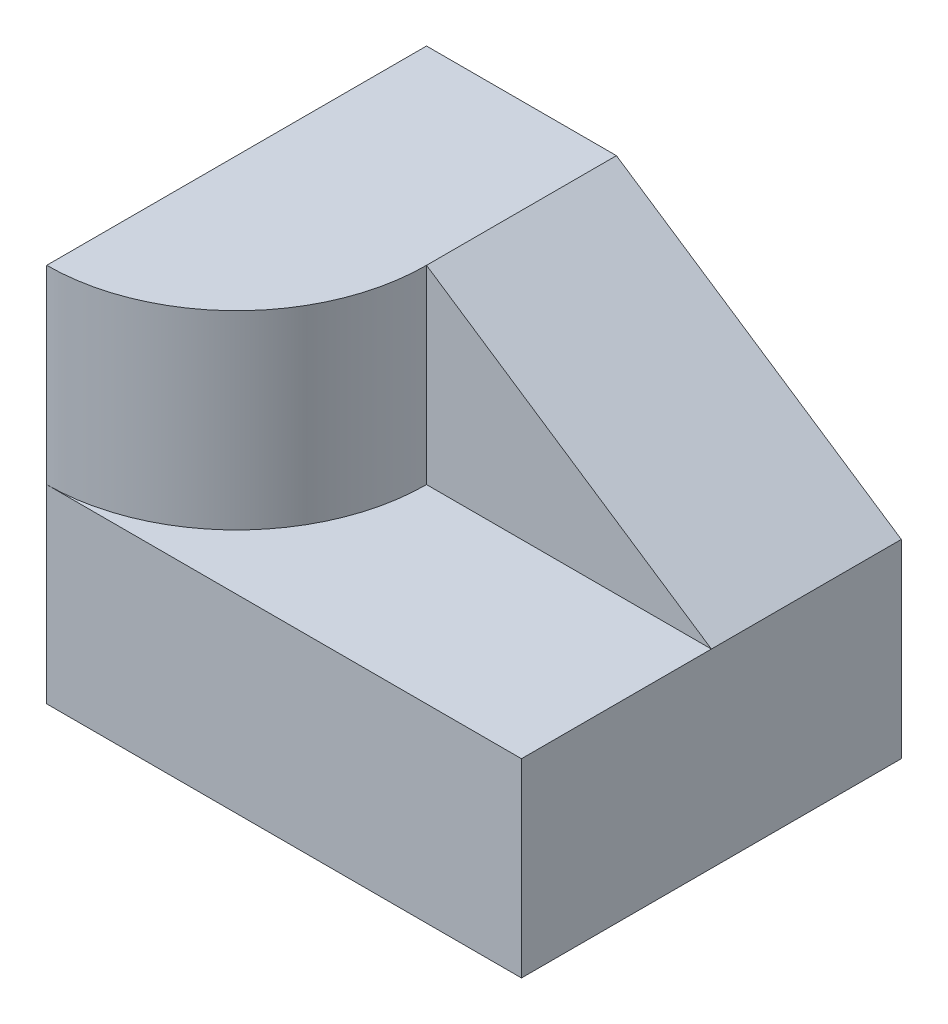
from build123d import *

# Parameters (mm, degrees)
SKETCH_1_W      = 25
SKETCH_1_H      = 20
EXTRUDE_1_DEPTH = 10
EXTRUDE_2_DEPTH = 10
EXTRUDE_3_DEPTH = 10


with BuildPart() as part:
    # 草圖1 → 填料-伸長1 (new body)
    with BuildSketch(Plane(origin=(0, 0, 0), x_dir=(1, 0, 0), z_dir=(0, 1, 0))):
        with Locations((12.5, 10)):
            Rectangle(SKETCH_1_W, SKETCH_1_H)
    extrude(amount=EXTRUDE_1_DEPTH)

    # 草圖2 → 填料-伸長2 (add)
    with BuildSketch(Plane(origin=(0, 10, 0), x_dir=(1, 0, 0), z_dir=(0, 1, 0))):
        with BuildLine():
            Line((0, 20), (0, 0))
            ThreePointArc((0, 0), (7.071067812, 2.928932188), (10, 10))
            Line((10, 10), (10, 20))
            Line((10, 20), (0, 20))
        make_face()
    extrude(amount=EXTRUDE_2_DEPTH)

    # 草圖3 → 填料-伸長3 (add)
    with BuildSketch(Plane(origin=(0, 0, -20), x_dir=(-1, 0, 0), z_dir=(0, 0, -1))):
        Polygon((-10, 20), (-10, 10), (-25, 10), align=None)
    extrude(amount=-EXTRUDE_3_DEPTH)


solid = part.part
